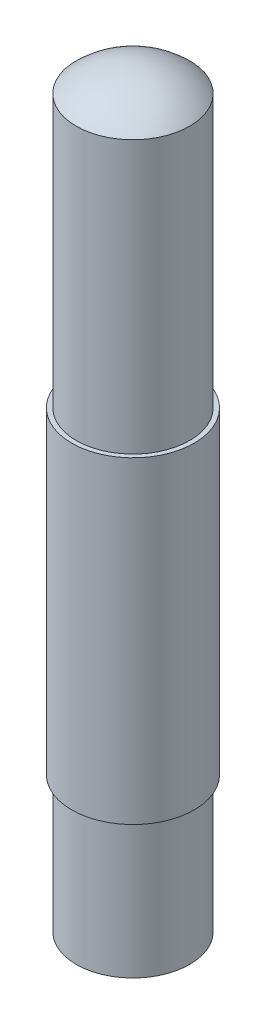
from build123d import *

# Parameters (mm, degrees)
DOME1_FACE_RADIUS = 12.5
DOME1_HEIGHT      = 5


with BuildPart() as part:
    # Sketch1 → Revolve2 (revolve)
    with BuildSketch(Plane.XY, mode=Mode.PRIVATE) as revolve2_sk:
        Polygon((0, 0), (-12.5, 0), (-12.5, 30), (-13.5, 30), (-13.5, 100), (-12.5, 100), (-12.5, 160), (0, 160), align=None)
    revolve(revolve2_sk.sketch.rotate(Axis((0, 160, 0), (0, -1, 0)), 270), axis=Axis((0, 160, 0), (0, -1, 0)))

    # Dome1: a dome of height H over a round flat face of radius A is a cap of a sphere of radius (A * A + H * H) / (2 * H)
    dome1_r = (DOME1_FACE_RADIUS * DOME1_FACE_RADIUS + DOME1_HEIGHT * DOME1_HEIGHT) / (2 * DOME1_HEIGHT)
    dome1_base = Plane((0, 160, 0), z_dir=(0, 1, 0))
    with Locations(dome1_base.offset(DOME1_HEIGHT - dome1_r)):
        dome1_ball = Sphere(dome1_r, mode=Mode.PRIVATE)
    add(split(dome1_ball, bisect_by=dome1_base, keep=Keep.TOP, mode=Mode.PRIVATE))


solid = part.part
